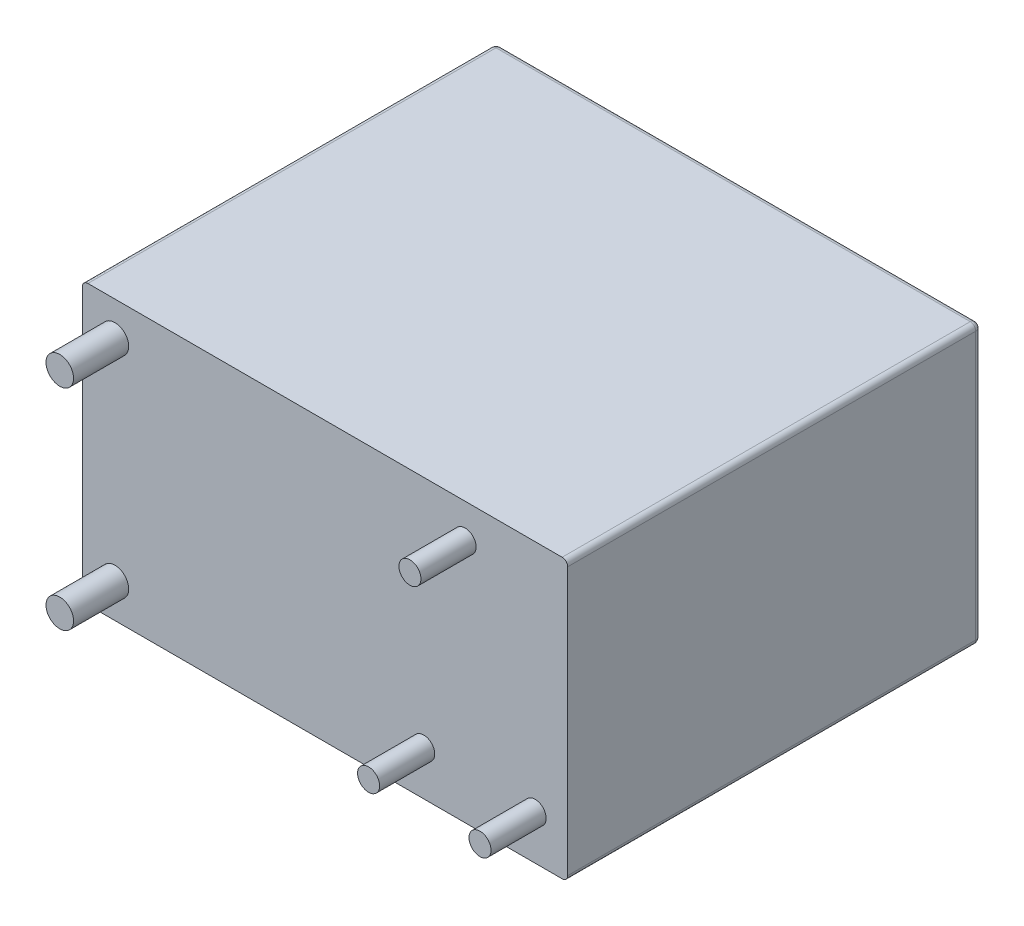
from build123d import *

# Parameters (mm, degrees)
SKETCH_1_W          = 17.6
SKETCH_1_H          = 10.1
EXTRUDE_1_DEPTH     = 15
SKETCH_2_R          = 0.5
SKETCH_2_R_2        = 0.4
EXTRUDE_2_DEPTH     = 2
FILLET_1_R          = 0.2
SKETCH_3_R          = 0.5
CUT_EXTRUDE_1_DEPTH = 0.5


with BuildPart() as part:
    # 草图1 → 凸台-拉伸1 (new body)
    with BuildSketch(Plane.XY):
        with Locations((8.8, 5.05)):
            Rectangle(SKETCH_1_W, SKETCH_1_H)
    extrude(amount=-EXTRUDE_1_DEPTH)

    # 草图2 → 凸台-拉伸2 (add)
    with BuildSketch(Plane.XY):
        with Locations(Location((1.18, 8.86, 0), (0, 0, 180))):
            Circle(SKETCH_2_R)
        with Locations(Location((13.88, 8.86, 0), (0, 0, 180))):
            Circle(SKETCH_2_R_2)
        with Locations(Location((12.38, 1.606982533, 0), (0, 0, 180))):
            Circle(SKETCH_2_R_2)
        with Locations(Location((16.42, 1.606982533, 0), (0, 0, 180))):
            Circle(SKETCH_2_R_2)
        with Locations(Location((1.18, 1.24, 0), (0, 0, 180))):
            Circle(SKETCH_2_R)
    extrude(amount=EXTRUDE_2_DEPTH)

    # 圆角1
    fillet_1_edges = [part.edges().sort_by_distance(p)[0] for p in [
        (17.6, 5.05, -15),
        (8.8, 10.1, -15),
        (0, 5.05, -15),
        (8.8, 0, -15),
        (0, 10.1, -7.5),
        (17.6, 10.1, -7.5),
        (17.6, 0, -7.5),
        (0, 0, -7.5),
    ]]
    fillet(fillet_1_edges, radius=FILLET_1_R)

    # 草图3 → 切除-拉伸1 (cut)
    with BuildSketch(Plane(origin=(0, 0, -15), x_dir=(-1, 0, 0), z_dir=(0, 0, -1))):
        with Locations((-1.939258316, 1.326985708)):
            Circle(SKETCH_3_R)
    extrude(amount=-CUT_EXTRUDE_1_DEPTH, mode=Mode.SUBTRACT)


solid = part.part
